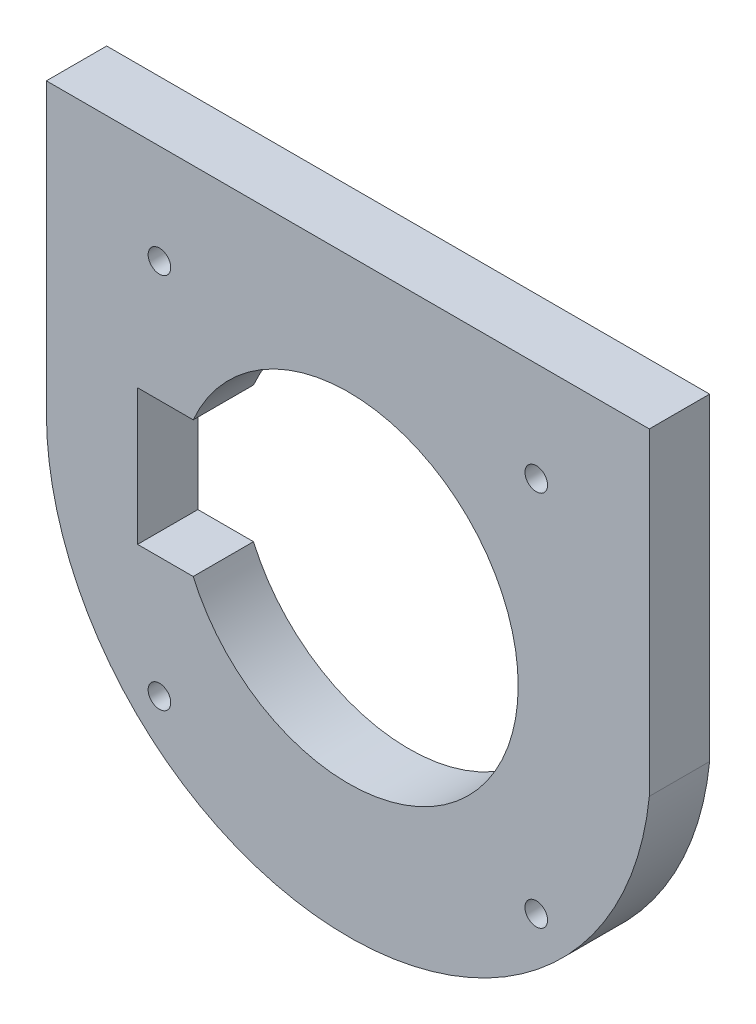
from build123d import *

# Parameters (mm, degrees)
SKETCH_1_W          = 100
SKETCH_1_H          = 100
EXTRUDE_1_DEPTH     = 8
SKETCH_2_OUTSIDE_W  = 130.33
SKETCH_2_OUTSIDE_H  = 130.33
CUT_EXTRUDE_1_DEPTH = 142.647449677
SKETCH_3_R          = 1.5
CUT_EXTRUDE_2_DEPTH = 133.94238179


with BuildPart() as part:
    # 草图1 → 凸台-拉伸1 (new body)
    with BuildSketch(Plane.XY):
        with Locations((50, 50)):
            Rectangle(SKETCH_1_W, SKETCH_1_H)
    extrude(amount=EXTRUDE_1_DEPTH)

    # 草图2 outside → 切除-拉伸1 (cut, through all)
    with BuildSketch(Plane.XY.offset(8)):
        with Locations((50, 50)):
            Rectangle(SKETCH_2_OUTSIDE_W, SKETCH_2_OUTSIDE_H)
        with BuildLine():
            Line((90, 97.517572139), (90, 55.3))
            ThreePointArc((90, 55.3), (48.097501561, 19.250031211), (10, 59.3))
            Line((10, 59.3), (10, 97.517572139))
            Line((10, 97.517572139), (90, 97.517572139))
        make_face(mode=Mode.SUBTRACT)
    extrude(amount=-CUT_EXTRUDE_1_DEPTH, mode=Mode.SUBTRACT)

    # 草图3 → 切除-拉伸2 (cut, through all)
    with BuildSketch(Plane.XY.offset(8)):
        with Locations((75, 84.3)):
            Circle(SKETCH_3_R)
        with Locations(Location((75, 34.3, 0), (0, 0, 180))):
            Circle(SKETCH_3_R)
        with Locations((25, 34.3)):
            Circle(SKETCH_3_R)
        with Locations(Location((25, 84.3, 0), (0, 0, 180))):
            Circle(SKETCH_3_R)
        with BuildLine():
            Line((29.478409373, 68.3), (22.1, 68.3))
            Line((22.1, 68.3), (22.1, 50.3))
            Line((22.1, 50.3), (29.478409373, 50.3))
            ThreePointArc((29.478409373, 50.3), (72.6, 59.3), (29.478409373, 68.3))
        make_face()
    extrude(amount=-CUT_EXTRUDE_2_DEPTH, mode=Mode.SUBTRACT)


solid = part.part
